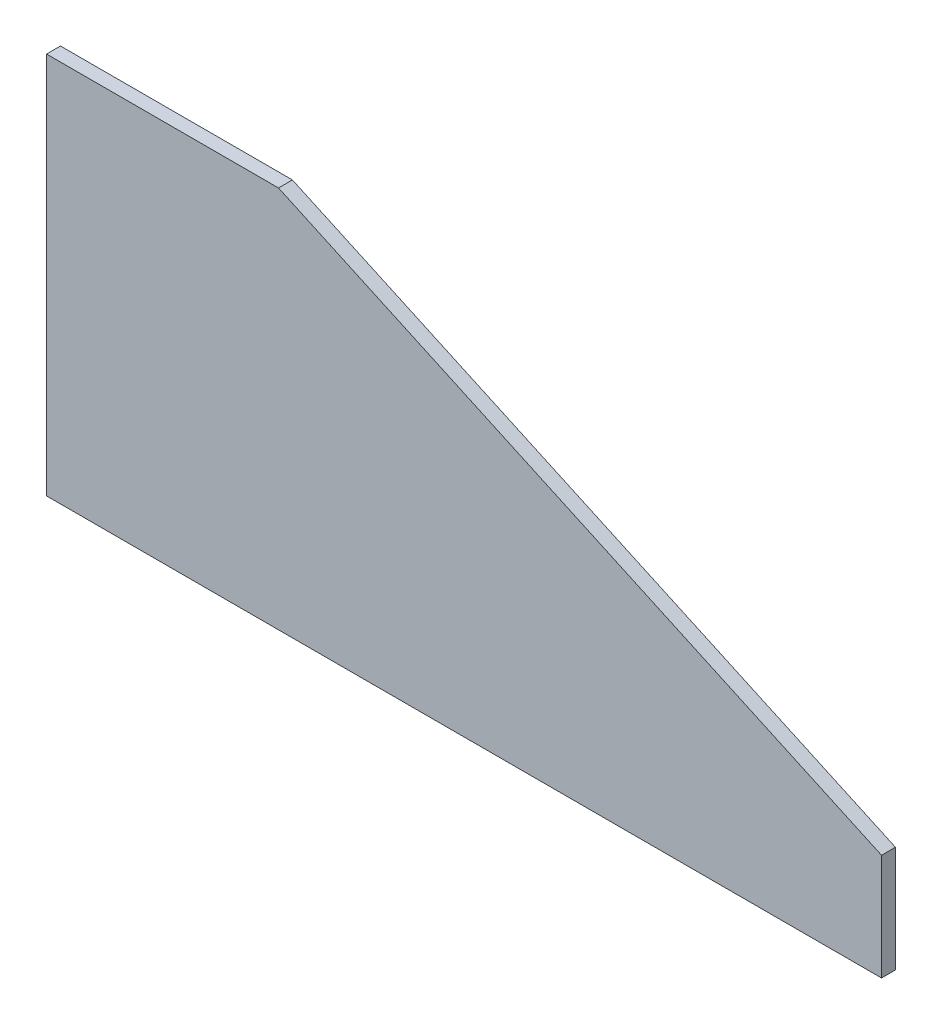
from build123d import *

# Parameters (mm, degrees)
BOSS_EXTRUDE1_DEPTH = 1


with BuildPart() as part:
    # Sketch1 → Boss-Extrude1 (new body)
    with BuildSketch(Plane.XY):
        Polygon((-13.332931237, 13.75), (30, -6.110926817), (30, -13.75), (-30, -13.75), (-30, 13.75), align=None)
    extrude(amount=BOSS_EXTRUDE1_DEPTH)


solid = part.part
